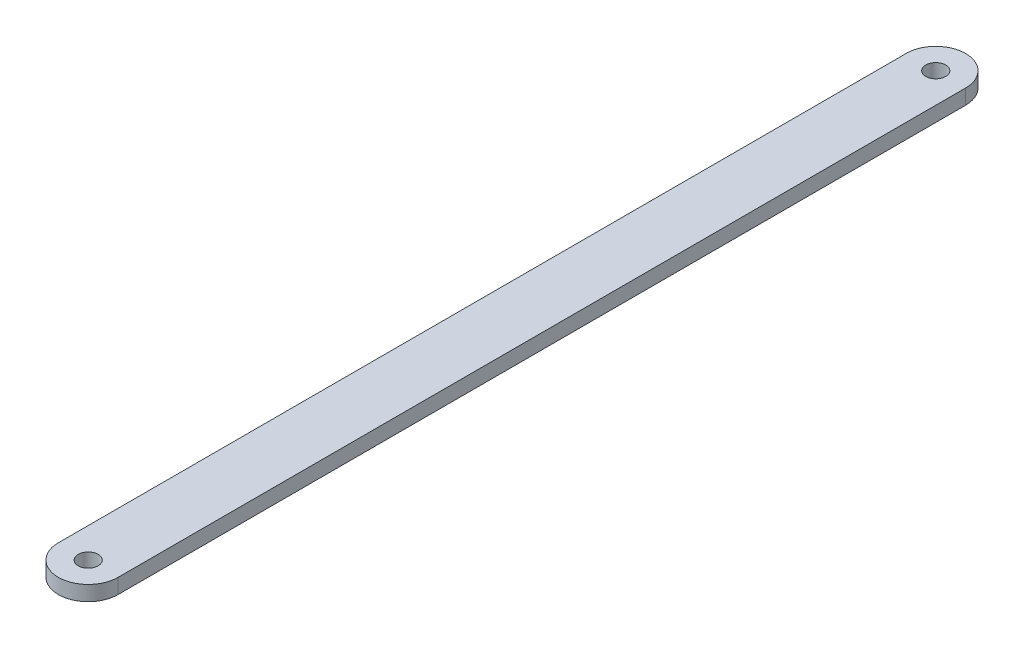
from build123d import *

# Parameters (mm, degrees)
SKETCH1_R           = 2
BOSS_EXTRUDE1_DEPTH = 1.5


with BuildPart() as part:
    # Sketch1 → Boss-Extrude1 (new, symmetric)
    with BuildSketch(Plane(origin=(0, 0, 0), x_dir=(1, 0, 0), z_dir=(0, 1, 0))):
        with BuildLine():
            Line((-6.312384572, -84.941682553), (-6.312384976, -84.943885306))
            ThreePointArc((-6.312384976, -84.943885306), (-0.312384976, -90.943885306), (5.687615024, -84.943885306))
            Line((5.687615024, -84.943885306), (5.687615024, 85.184041034))
            ThreePointArc((5.687615024, 85.184041034), (-0.617919518, 91.176256705), (-6.281267857, 84.573764744))
            Line((-6.281267857, 84.573764744), (-6.312384572, -84.941682553))
        make_face()
        with Locations(Location((-0.312384976, -84.943885306, 0), (0, 0, 270))):
            Circle(SKETCH1_R, mode=Mode.SUBTRACT)
        with Locations(Location((-0.312384976, 85.184041034, 0), (0, 0, 270))):
            Circle(SKETCH1_R, mode=Mode.SUBTRACT)
    extrude(amount=BOSS_EXTRUDE1_DEPTH, both=True)


solid = part.part
